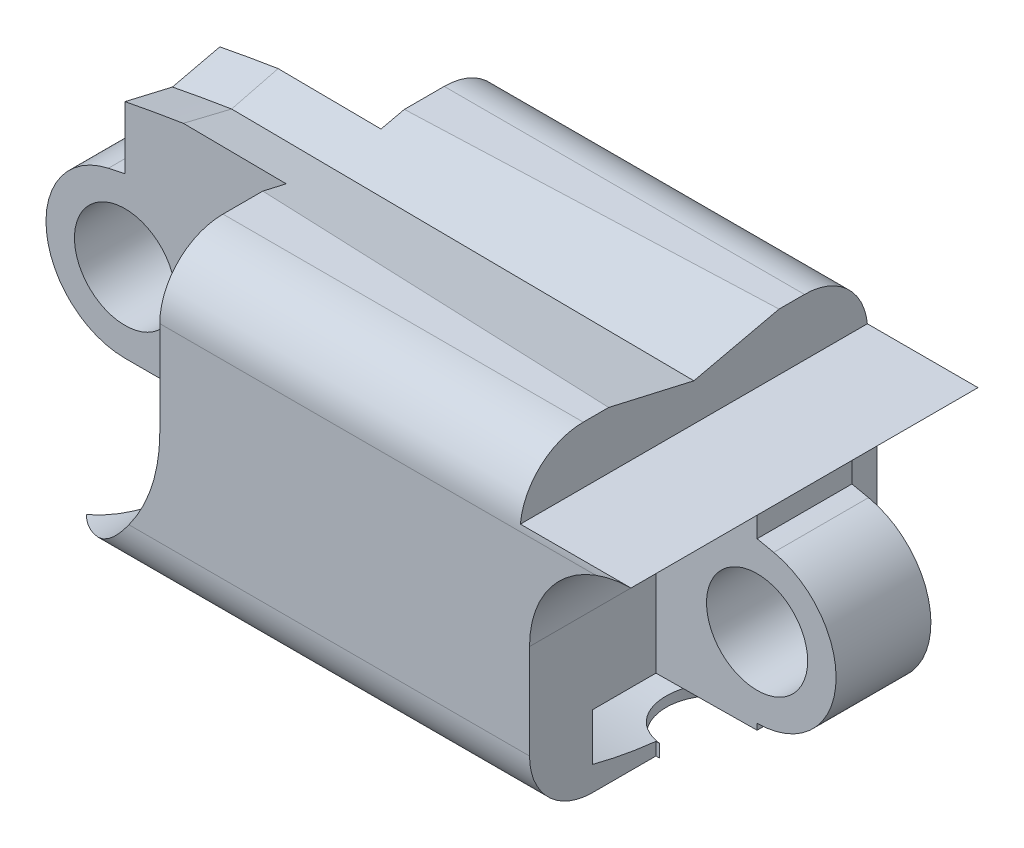
from build123d import *
from build123d.topology import SkipClean

# Parameters (mm, degrees)
SKETCH1_R               = 1.6
BOSS_EXTRUDE1_DEPTH     = 1.5
SKETCH2_W               = 18
SKETCH2_H               = 5
BOSS_EXTRUDE3_DEPTH     = 20
CUT_EXTRUDE3_DEPTH      = 4
CUT_EXTRUDE1_DEPTH      = 4
CUT_EXTRUDE4_DEPTH      = 6
CUT_EXTRUDE5_DEPTH      = 25.088378991
CUT_EXTRUDE5_DEPTH_BACK = 25.088378991
SKETCH11_R              = 1.6
CUT_EXTRUDE6_DEPTH      = 10
SKETCH13_R              = 4.127392351
CUT_EXTRUDE7_DEPTH      = 2.5
CUT_EXTRUDE8_START      = -3.5
CUT_EXTRUDE8_DEPTH      = 3.5


with BuildPart() as part:
    # Sketch1 → Boss-Extrude1 (new, symmetric)
    with BuildSketch(Plane.XY):
        with BuildLine():
            Line((0, -2.5), (20, -2.5))
            ThreePointArc((20, -2.5), (22.485953156, -0.264644865), (20.526315789, 2.443970476))
            ThreePointArc((20.526315789, 2.443970476), (10, 3.564560947), (-0.526315789, 2.443970476))
            ThreePointArc((-0.526315789, 2.443970476), (-2.485953156, -0.264644865), (0, -2.5))
        make_face()
        Circle(SKETCH1_R, mode=Mode.SUBTRACT)
        with Locations((20, 0)):
            Circle(SKETCH1_R, mode=Mode.SUBTRACT)
    extrude(amount=BOSS_EXTRUDE1_DEPTH, both=True)

    # Sketch2 → Revolve1 (revolve)
    with BuildSketch(Plane(origin=(0, 0, 0), x_dir=(1, 0, 0), z_dir=(0, 1, 0))):
        with Locations((11, -2.5)):
            Rectangle(SKETCH2_W, SKETCH2_H)
    revolve(axis=Axis((2, 0, 0), (1, 0, 0)))

    # Sketch9 → Boss-Extrude3 (add)
    with BuildSketch(Plane(origin=(0, 0, 0), x_dir=(0, 0, -1), z_dir=(1, 0, 0))):
        with BuildLine():
            Line((-3.5, -5), (3.5, -5))
            ThreePointArc((3.5, -5), (4.914213562, -4.414213562), (5.5, -3))
            Line((5.5, -3), (5.5, 3))
            ThreePointArc((5.5, 3), (4.914213562, 4.414213562), (3.5, 5))
            Line((3.5, 5), (-3.5, 5))
            ThreePointArc((-3.5, 5), (-4.914213562, 4.414213562), (-5.5, 3))
            Line((-5.5, 3), (-5.5, -3))
            ThreePointArc((-5.5, -3), (-4.914213562, -4.414213562), (-3.5, -5))
        make_face()
    extrude(amount=BOSS_EXTRUDE3_DEPTH)

    # Cut-Sweep1: sweep along a path in Sketch4
    with BuildLine(Plane.XY) as cut_sweep1_path:
        Line((24.863277649, 2.710997103), (2, 2.920411664))
        ThreePointArc((2, 2.920411664), (0.733779453, 2.698430699), (-0.526315789, 2.443970476))
        Line((-0.526315789, 2.443970476), (-4.067756882, 1.923712717))
    # Sketch3 → Cut-Sweep1 (sweep, cut)
    with BuildSketch(Plane(origin=(0, 0, 0), x_dir=(0, 0, -1), z_dir=(1, 0, 0))):
        Polygon((3.5, 5), (0, 4.182726474), (-3.5, 5), (-3.5, 6.035180102), (3.681581058, 6.035180102), align=None)
    sweep(path=cut_sweep1_path.line, transition=Transition.RIGHT, mode=Mode.SUBTRACT)

    # Cut-Sweep3: sweep along a path in Sketch7
    with BuildLine(Plane.XY) as cut_sweep3_path:
        Line((0, -2.91172129), (20, -2.693253741))
    # Sketch6 → Cut-Sweep3 (sweep, cut)
    with BuildSketch(Plane(origin=(20, 0, 0), x_dir=(0, 0, -1), z_dir=(1, 0, 0))):
        with BuildLine():
            Line((3.5, -2.693253741), (3.5, -4.193253741))
            ThreePointArc((3.5, -4.193253741), (0, -4.643536391), (-3.5, -4.193253741))
            Line((-3.5, -4.193253741), (-3.5, -2.693253741))
            Line((-3.5, -2.693253741), (3.5, -2.693253741))
        make_face()
    sweep(path=cut_sweep3_path.line, mode=Mode.SUBTRACT)

    # Sketch8 → Cut-Extrude3 (cut)
    with BuildSketch(Plane.XY.offset(1.5)):
        with BuildLine():
            Line((16.8, 0), (16.8, -2))
            Line((16.8, -2), (16.8, -5))
            Line((16.8, -5), (20, -5))
            Line((20, -5), (20, -3.2))
            ThreePointArc((20, -3.2), (22.2627417, 2.2627417), (16.8, 0))
        make_face()
    cut_extrude3 = extrude(amount=CUT_EXTRUDE3_DEPTH, mode=Mode.SUBTRACT)

    # Sketch5 → Cut-Extrude1 (cut)
    with BuildSketch(Plane.XY.offset(1.5)):
        with BuildLine():
            Line((5.1, 0), (5.1, 5.1))
            Line((5.1, 5.1), (0, 5.1))
            ThreePointArc((0, 5.1), (-3.606244584, -3.606244584), (5.1, 0))
        make_face()
    cut_extrude1 = extrude(amount=CUT_EXTRUDE1_DEPTH, mode=Mode.SUBTRACT)

    # Mirror1: Cut-Extrude3, Cut-Extrude1 across plane
    add(cut_extrude3.mirror(Plane.XY), mode=Mode.SUBTRACT)
    add(cut_extrude1.mirror(Plane.XY), mode=Mode.SUBTRACT)

    # Sketch10 → Cut-Extrude4 (cut)
    with BuildSketch(Plane(origin=(0.031802036, -2.911373904, 0), x_dir=(0.9999403452508379, 0.01092272583357663, 0), z_dir=(0.01092272583357663, -0.9999403452508379, 0))):
        with BuildLine():
            Line((17.174273437, 1.517261574), (23.592478812, 1.517261574))
            Line((23.592478812, 1.517261574), (23.592478812, -1.517261574))
            Line((23.592478812, -1.517261574), (17.174357812, -1.517261574))
            Line((17.174357812, -1.517261574), (17.08845436, -1.517261574))
            ThreePointArc((17.08845436, -1.517261574), (15.571192786, 0), (17.08845436, 1.517261574))
            Line((17.08845436, 1.517261574), (17.174273437, 1.517261574))
        make_face()
    extrude(amount=CUT_EXTRUDE4_DEPTH, mode=Mode.SUBTRACT)

    # Sketch11 → Cut-Extrude5 (cut, two sides: drawn at the far end of the back side and taken through both)
    with SkipClean():  # the faces are left unmerged after this step: merging them gives an invalid solid
        with BuildSketch(Plane.XY.offset(1.5).offset(-CUT_EXTRUDE5_DEPTH_BACK)):
            with Locations((20, 0)):
                Circle(SKETCH11_R)
            Circle(SKETCH11_R)
        extrude(amount=CUT_EXTRUDE5_DEPTH + CUT_EXTRUDE5_DEPTH_BACK, mode=Mode.SUBTRACT)

    # Sketch12 → Cut-Extrude6 (cut)
    with SkipClean():  # the faces are left unmerged after this step: merging them gives an invalid solid
        with BuildSketch(Plane.XY.offset(1.5)):
            with BuildLine():
                Line((2, -2.5), (4.445222154, -2.5))
                ThreePointArc((4.445222154, -2.5), (2.659498662, -4.35167403), (0.197141337, -5.09618831))
                Line((0.197141337, -5.09618831), (-0.979949821, -5.09618831))
                Line((-0.979949821, -5.09618831), (-0.979949821, -2.5))
                Line((-0.979949821, -2.5), (2, -2.5))
            make_face()
        extrude(amount=-CUT_EXTRUDE6_DEPTH, mode=Mode.SUBTRACT)

    # Sketch13 → Cut-Extrude7 (cut)
    with BuildSketch(Plane.XZ.offset(5)):
        Circle(SKETCH13_R)
    extrude(amount=-CUT_EXTRUDE7_DEPTH, mode=Mode.SUBTRACT)

    # Sketch15 → Cut-Extrude8 (cut)
    with BuildSketch(Plane(origin=(20, 0, 0), x_dir=(0, 0, -1), z_dir=(1, 0, 0)).offset(CUT_EXTRUDE8_START)):
        with BuildLine():
            Line((-2.836208081, 5), (2.836208081, 5))
            Line((2.836208081, 5), (3.5, 5))
            ThreePointArc((3.5, 5), (4.841640786, 4.483239697), (5.489974874, 3.2))
            Line((5.489974874, 3.2), (1.5, 3.2))
            Line((1.5, 3.2), (-1.5, 3.2))
            Line((-1.5, 3.2), (-5.489974874, 3.2))
            ThreePointArc((-5.489974874, 3.2), (-4.841640786, 4.483239697), (-3.5, 5))
            Line((-3.5, 5), (-2.836208081, 5))
        make_face()
    extrude(amount=CUT_EXTRUDE8_DEPTH, mode=Mode.SUBTRACT)


solid = part.part
